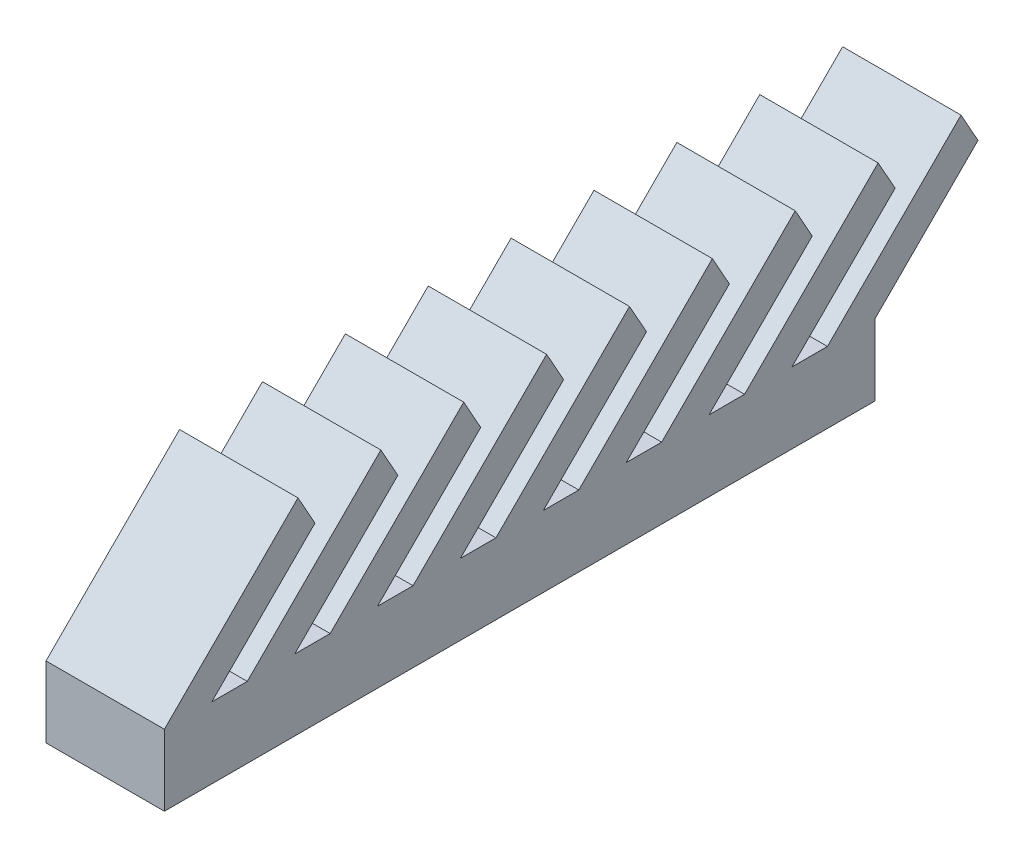
from build123d import *

# Parameters (mm, degrees)
SKETCH1_W           = 30
SKETCH1_H           = 3
BOSS_EXTRUDE1_DEPTH = 5
BOSS_EXTRUDE3_DEPTH = 5
LPATTERN2_COUNT     = 9
LPATTERN2_PITCH     = 3.5


with BuildPart() as part:
    # Sketch1 → Boss-Extrude1 (new body)
    with BuildSketch(Plane(origin=(0, 0, 0), x_dir=(0, 0, -1), z_dir=(1, 0, 0))):
        Rectangle(SKETCH1_W, SKETCH1_H)
    extrude(amount=BOSS_EXTRUDE1_DEPTH)

    # Sketch2 → Boss-Extrude3 (add)
    with BuildSketch(Plane(origin=(5, 0, 0), x_dir=(0, 0, -1), z_dir=(1, 0, 0))):
        Polygon((15, 1.5), (13, 1.5), (18.641236999, 7.141236999), (19.358763001, 5.858763001), align=None)
    boss_extrude3 = extrude(amount=-BOSS_EXTRUDE3_DEPTH)

    # LPattern2: Boss-Extrude3 ×9
    with Locations(*[(0, 0, i * LPATTERN2_PITCH) for i in range(1, LPATTERN2_COUNT)]):
        add(boss_extrude3)


solid = part.part
